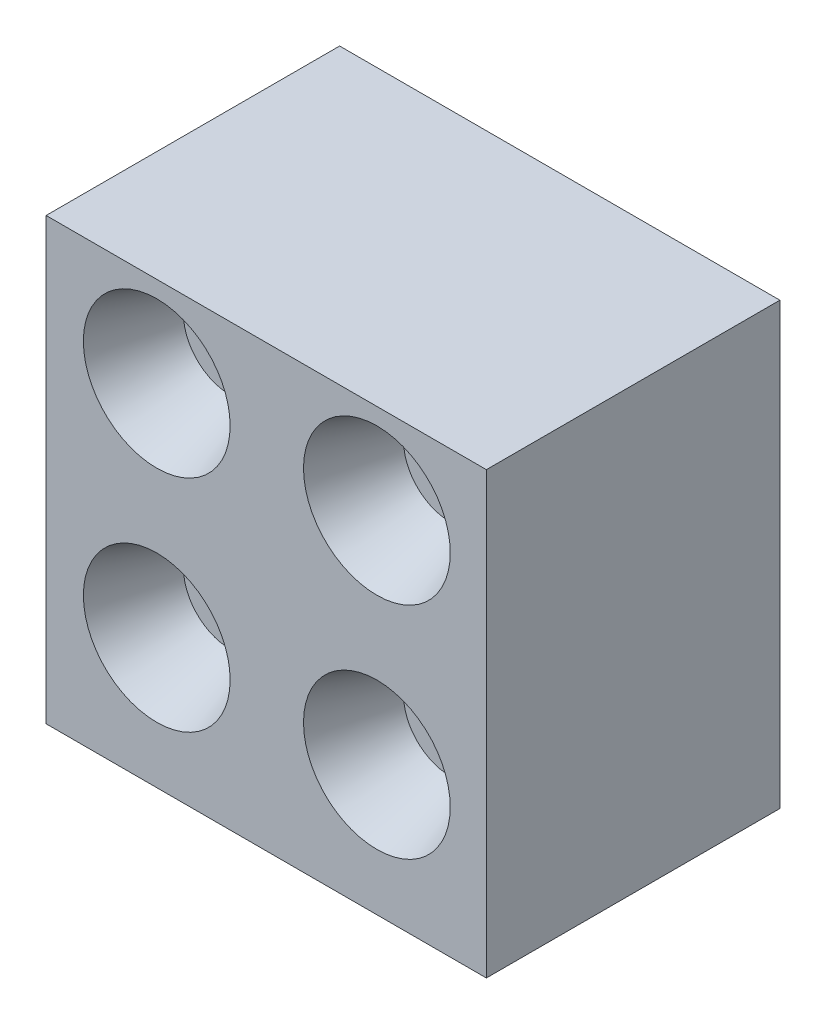
from build123d import *

# Parameters (mm, degrees)
SKETCH1_W                 = 3048
SKETCH1_H                 = 3048
BOSS_EXTRUDE1_DEPTH       = 2032
CUT_EXTRUDE1_START        = 2032
SKETCH2_R                 = 508
CUT_EXTRUDE1_DEPTH        = 508
CUT_EXTRUDE1_DRAFT        = -20
LPATTERN1_START           = 2032
LPATTERN1_COPY_1_SKETCH_R = 508
LPATTERN1_COPY_1_DEPTH    = 508
LPATTERN1_COPY_1_DRAFT    = -20
LPATTERN1_COPY_2_SKETCH_R = 508
LPATTERN1_COPY_2_DEPTH    = 508
LPATTERN1_COPY_2_DRAFT    = -20
LPATTERN1_COPY_3_SKETCH_R = 508
LPATTERN1_COPY_3_DEPTH    = 508
LPATTERN1_COPY_3_DRAFT    = -20


with BuildPart() as part:
    # Sketch1 → Boss-Extrude1 (new body)
    with BuildSketch(Plane.XY):
        with Locations((1524, 1524)):
            Rectangle(SKETCH1_W, SKETCH1_H)
    extrude(amount=BOSS_EXTRUDE1_DEPTH)


with BuildPart() as cut_extrude1_tool:
    # Sketch2 → Cut-Extrude1 (with draft: the straight prism first)
    with BuildSketch(Plane.XY.offset(CUT_EXTRUDE1_START)):
        with Locations((765.92836786, 2423.73148259)):
            Circle(SKETCH2_R)
    extrude(amount=-CUT_EXTRUDE1_DEPTH)
    # Cut-Extrude1: the draft: its side faces are tilted about the plane it starts from
    cut_extrude1_sides = [cut_extrude1_tool.faces().sort_by_distance(p)[0] for p in [
        (257.92836786, 2423.73148259, 1778),
    ]]
    draft(cut_extrude1_sides, Plane.XY.offset(CUT_EXTRUDE1_START), CUT_EXTRUDE1_DRAFT)


with BuildPart() as part_1:
    add(part.part)

    # Cut-Extrude1: cut by cut_extrude1_tool
    add(cut_extrude1_tool.part, mode=Mode.SUBTRACT)


with BuildPart() as lpattern1_copy_1_tool:
    # LPattern1 copy 1 sketch → LPattern1 copy 1 (with draft: the straight prism first)
    with BuildSketch(Plane(origin=(0, -1524, 0), x_dir=(1, 0, 0), z_dir=(0, 0, 1)).offset(LPATTERN1_START)):
        with Locations((765.92836786, 2423.73148259)):
            Circle(LPATTERN1_COPY_1_SKETCH_R)
    extrude(amount=-LPATTERN1_COPY_1_DEPTH)
    # LPattern1 copy 1: the draft: its side faces are tilted about the plane it starts from
    lpattern1_copy_1_sides = [lpattern1_copy_1_tool.faces().sort_by_distance(p)[0] for p in [
        (257.92836786, 899.73148259, 1778),
    ]]
    draft(lpattern1_copy_1_sides, Plane(origin=(0, -1524, 0), x_dir=(1, 0, 0), z_dir=(0, 0, 1)).offset(LPATTERN1_START), LPATTERN1_COPY_1_DRAFT)


with BuildPart() as part_2:
    add(part_1.part)

    # LPattern1 copy 1: cut by lpattern1_copy_1_tool
    add(lpattern1_copy_1_tool.part, mode=Mode.SUBTRACT)


with BuildPart() as lpattern1_copy_2_tool:
    # LPattern1 copy 2 sketch → LPattern1 copy 2 (with draft: the straight prism first)
    with BuildSketch(Plane(origin=(1524, 0, 0), x_dir=(1, 0, 0), z_dir=(0, 0, 1)).offset(LPATTERN1_START)):
        with Locations((765.92836786, 2423.73148259)):
            Circle(LPATTERN1_COPY_2_SKETCH_R)
    extrude(amount=-LPATTERN1_COPY_2_DEPTH)
    # LPattern1 copy 2: the draft: its side faces are tilted about the plane it starts from
    lpattern1_copy_2_sides = [lpattern1_copy_2_tool.faces().sort_by_distance(p)[0] for p in [
        (1781.92836786, 2423.73148259, 1778),
    ]]
    draft(lpattern1_copy_2_sides, Plane(origin=(1524, 0, 0), x_dir=(1, 0, 0), z_dir=(0, 0, 1)).offset(LPATTERN1_START), LPATTERN1_COPY_2_DRAFT)


with BuildPart() as part_3:
    add(part_2.part)

    # LPattern1 copy 2: cut by lpattern1_copy_2_tool
    add(lpattern1_copy_2_tool.part, mode=Mode.SUBTRACT)


with BuildPart() as lpattern1_copy_3_tool:
    # LPattern1 copy 3 sketch → LPattern1 copy 3 (with draft: the straight prism first)
    with BuildSketch(Plane(origin=(1524, -1524, 0), x_dir=(1, 0, 0), z_dir=(0, 0, 1)).offset(LPATTERN1_START)):
        with Locations((765.92836786, 2423.73148259)):
            Circle(LPATTERN1_COPY_3_SKETCH_R)
    extrude(amount=-LPATTERN1_COPY_3_DEPTH)
    # LPattern1 copy 3: the draft: its side faces are tilted about the plane it starts from
    lpattern1_copy_3_sides = [lpattern1_copy_3_tool.faces().sort_by_distance(p)[0] for p in [
        (1781.92836786, 899.73148259, 1778),
    ]]
    draft(lpattern1_copy_3_sides, Plane(origin=(1524, -1524, 0), x_dir=(1, 0, 0), z_dir=(0, 0, 1)).offset(LPATTERN1_START), LPATTERN1_COPY_3_DRAFT)


with BuildPart() as part_4:
    add(part_3.part)

    # LPattern1 copy 3: cut by lpattern1_copy_3_tool
    add(lpattern1_copy_3_tool.part, mode=Mode.SUBTRACT)


solid = part_4.part
